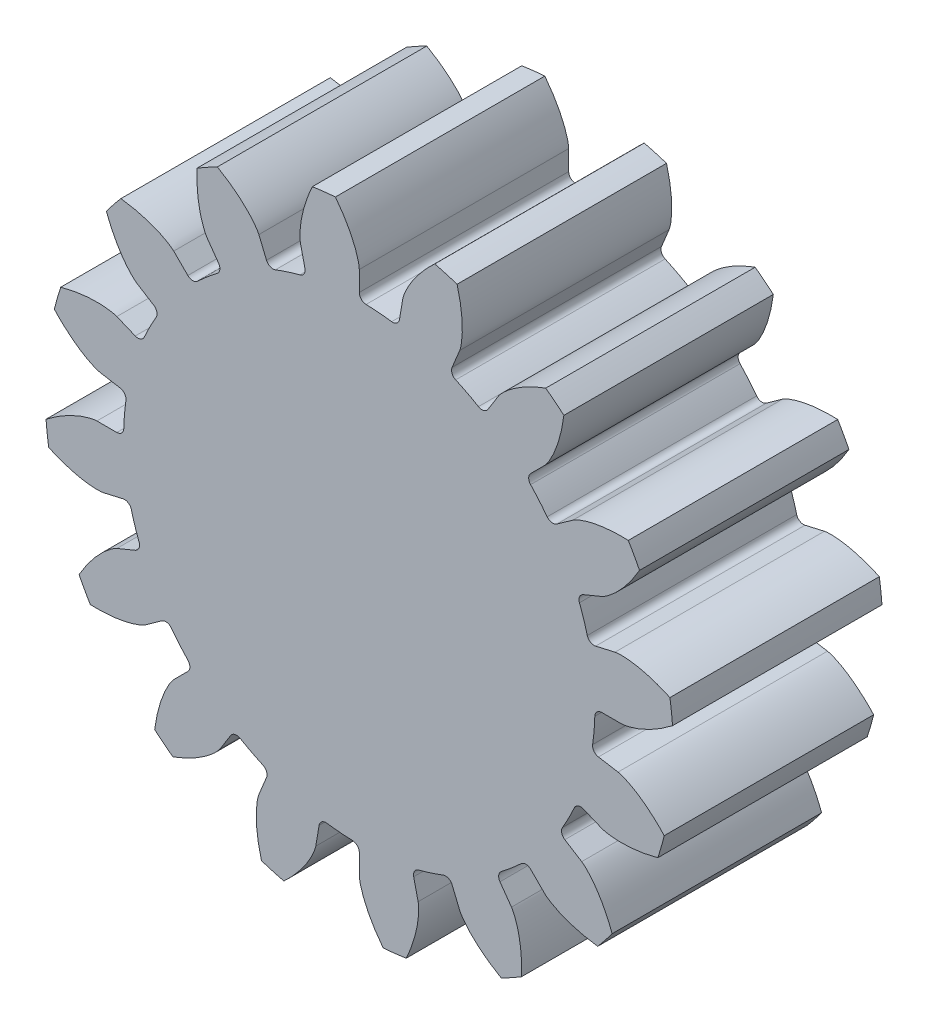
from build123d import *

# Parameters (mm, degrees)
SKETCH1_R                 = 4.5
BOSS_EXTRUDE1_DEPTH       = 3
CUT_EXTRUDE1_DEPTH        = 8.03562364
FILLET1_R                 = 0.1
FILLET2_R                 = 0.1
CIRPATTERN14_COUNT        = 16
FILLET1_OF_CIRPATTERN14_R = 0.1
FILLET2_OF_CIRPATTERN14_R = 0.1


with BuildPart() as part:
    # Sketch1 → Boss-Extrude1 (new body)
    with BuildSketch(Plane.XY):
        Circle(SKETCH1_R)
    extrude(amount=BOSS_EXTRUDE1_DEPTH)

    # Sketch3 → Cut-Extrude1 (cut, symmetric)
    with BuildSketch(Plane.XY):
        with BuildLine():
            Line((3.758770483, 0), (3.375, 0))
            ThreePointArc((3.375, 0), (3.363305707, -0.280712883), (3.328303868, -0.55948044))
            Line((3.328303868, -0.55948044), (3.706764544, -0.623098834))
            add(Edge.make_bspline(
                [(3.706764544, -0.623098834), (3.710310814, -0.623747542), (3.716960391, -0.625269417), (3.727742892, -0.628070561), (3.74882935, -0.634408224), (3.772379936, -0.642672641), (3.798673134, -0.653085096), (3.826602443, -0.665346406), (3.850266916, -0.676490602), (3.873663509, -0.688218636), (3.89677454, -0.700450417), (3.924527811, -0.715910893), (3.957464063, -0.735341888), (3.995435281, -0.759340464), (4.037858637, -0.788067193), (4.080372266, -0.818936689), (4.121599452, -0.850614202), (4.162522286, -0.884094428), (4.201596252, -0.917531849), (4.241391408, -0.953744573), (4.277724947, -0.987926925), (4.316913638, -1.027227372), (4.340435511, -1.051347069), (4.359211977, -1.071473981), (4.368180431, -1.081202905)],
                knots=[0, 0, 0, 0, 0, 0.015083688, 0.02853182, 0.04661014, 0.092110525, 0.119476176, 0.146842496, 0.174208854, 0.201574956, 0.228941013, 0.256307345, 0.307035032, 0.361767352, 0.416499661, 0.471231937, 0.525964282, 0.580696616, 0.635428982, 0.690161387, 0.744893688, 0.799626082, 0.851029126, 0.851029126, 0.851029126, 0.851029126, 0.851029126], degree=4))
            ThreePointArc((4.368180431, -1.081202905), (4.466923546, -0.544604471), (4.5, 0))
            ThreePointArc((4.5, 0), (4.496742799, 0.171184693), (4.486975912, 0.34212157))
            add(Edge.make_bspline(
                [(3.758770483, 0), (3.762375225, 5.1861e-05), (3.769185083, 0.000450366), (3.78028275, 0.001425316), (3.802128065, 0.004179748), (3.826722816, 0.008425792), (3.854378318, 0.014335506), (3.883953781, 0.021797273), (3.909138231, 0.028864373), (3.934155291, 0.036551639), (3.958974246, 0.044783021), (3.988906439, 0.055428873), (4.024608104, 0.069131115), (4.066032248, 0.086503085), (4.112630726, 0.107799751), (4.159673439, 0.131194571), (4.205581454, 0.155599485), (4.251488167, 0.181832623), (4.295564498, 0.208330039), (4.340812107, 0.237444806), (4.382309416, 0.265131132), (4.427470809, 0.297391435), (4.454665606, 0.317278147), (4.476518761, 0.334013973), (4.486975912, 0.34212157)],
                knots=[0, 0, 0, 0, 0, 0.015083688, 0.02853182, 0.04661014, 0.092110525, 0.119476176, 0.146842496, 0.174208854, 0.201574956, 0.228941013, 0.256307345, 0.307035032, 0.361767352, 0.416499661, 0.471231937, 0.525964282, 0.580696616, 0.635428982, 0.690161387, 0.744893688, 0.799626082, 0.851029126, 0.851029126, 0.851029126, 0.851029126, 0.851029126], degree=4))
        make_face()
    cut_extrude1 = extrude(amount=CUT_EXTRUDE1_DEPTH, both=True, mode=Mode.SUBTRACT)

    # Fillet1
    fillet1_edges = [part.edges().sort_by_distance(p)[0] for p in [
        (3.328303868, -0.55948044, 1.5),
    ]]
    fillet(fillet1_edges, radius=FILLET1_R)

    # Fillet2
    fillet2_edges = [part.edges().sort_by_distance(p)[0] for p in [
        (3.375, 0, 1.5),
    ]]
    fillet(fillet2_edges, radius=FILLET2_R)

    # CirPattern14: Cut-Extrude1 ×16 about axis
    cirpattern14_axis = Axis((0, 0, 3), (0, 0, -1))
    for i in range(1, CIRPATTERN14_COUNT):
        add(cut_extrude1.rotate(cirpattern14_axis, i * 360 / CIRPATTERN14_COUNT), mode=Mode.SUBTRACT)

    # Fillet1 of CirPattern14
    fillet1_of_cirpattern14_edges = [part.edges().sort_by_distance(p)[0] for p in [
        (2.860847926, -1.790579276, 1.5),
        (1.957853822, -2.749078648, 1.5),
        (0.756794221, -3.289055717, 1.5),
        (-0.55948044, -3.328303868, 1.5),
        (-1.790579276, -2.860847926, 1.5),
        (-2.749078648, -1.957853822, 1.5),
        (-3.289055717, -0.756794221, 1.5),
        (-3.328303868, 0.55948044, 1.5),
        (-2.860847926, 1.790579276, 1.5),
        (-1.957853822, 2.749078648, 1.5),
        (-0.756794221, 3.289055717, 1.5),
        (0.55948044, 3.328303868, 1.5),
        (1.790579276, 2.860847926, 1.5),
        (2.749078648, 1.957853822, 1.5),
        (3.289055717, 0.756794221, 1.5),
    ]]
    fillet(fillet1_of_cirpattern14_edges, radius=FILLET1_OF_CIRPATTERN14_R)

    # Fillet2 of CirPattern14
    fillet2_of_cirpattern14_edges = [part.edges().sort_by_distance(p)[0] for p in [
        (3.118093422, -1.291556584, 1.5),
        (2.386485387, -2.386485387, 1.5),
        (1.291556584, -3.118093422, 1.5),
        (0, -3.375, 1.5),
        (-1.291556584, -3.118093422, 1.5),
        (-2.386485387, -2.386485387, 1.5),
        (-3.118093422, -1.291556584, 1.5),
        (-3.375, 0, 1.5),
        (-3.118093422, 1.291556584, 1.5),
        (-2.386485387, 2.386485387, 1.5),
        (-1.291556584, 3.118093422, 1.5),
        (0, 3.375, 1.5),
        (1.291556584, 3.118093422, 1.5),
        (2.386485387, 2.386485387, 1.5),
        (3.118093422, 1.291556584, 1.5),
    ]]
    fillet(fillet2_of_cirpattern14_edges, radius=FILLET2_OF_CIRPATTERN14_R)


solid = part.part
